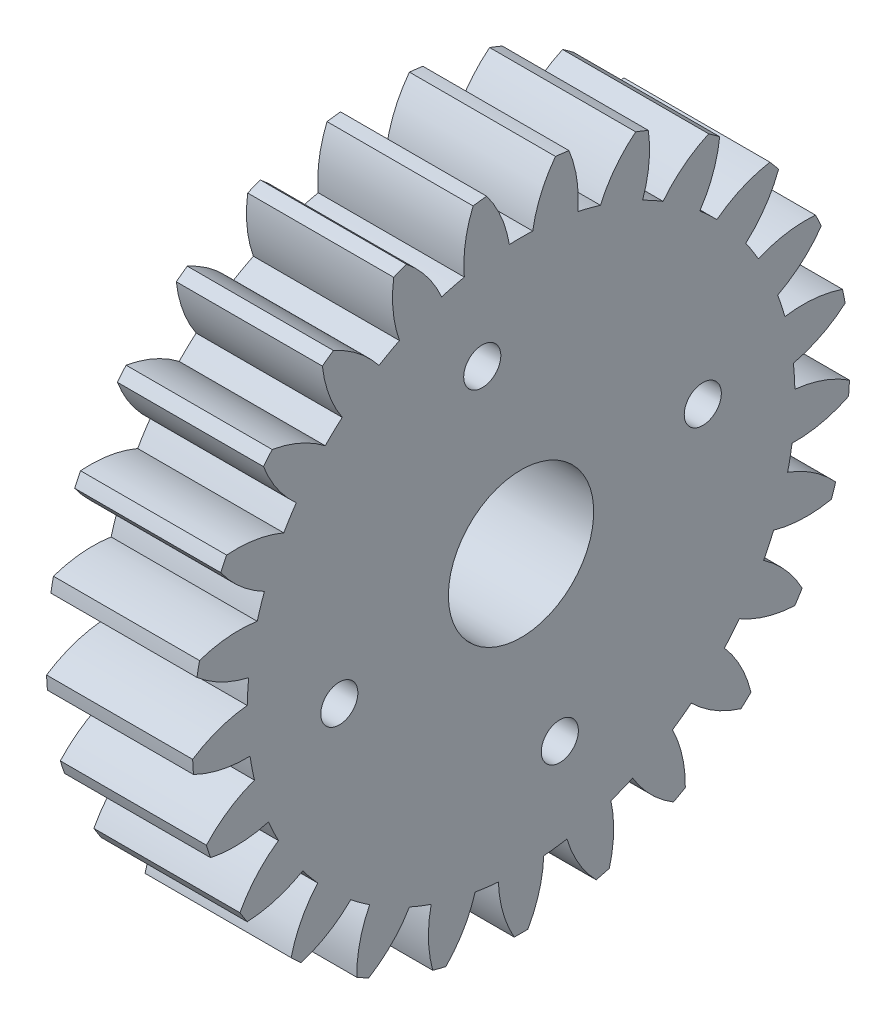
from build123d import *

# Parameters (mm, degrees)
BASPROSKE_W        = 6
BASPROSKE_H        = 13.5
TOOTHCUT_DEPTH     = 21.012496096
TEETHCUTS_COUNT    = 25
TEETHCUTS_ANGLE    = 345.6
BORSKE_R           = 2.5
BORE_DEPTH         = 50.0000508
SKETCH1_R          = 0.762
SKETCH1_R_2        = 2.9845
SKETCH1_R_3        = 2.5
CUT_EXTRUDE1_DEPTH = 149.550528118


with BuildPart() as part:
    # BasProSke → Base-Revolve (revolve)
    with BuildSketch(Plane(origin=(0, 0, 0), x_dir=(1, 0, 0), z_dir=(0, 1, 0)), mode=Mode.PRIVATE) as base_revolve_sk:
        with Locations((3, 6.75)):
            Rectangle(BASPROSKE_W, BASPROSKE_H)
    revolve(base_revolve_sk.sketch.rotate(Axis((-10, 0, 0), (1, 0, 0)), 180), axis=Axis((-10, 0, 0), (1, 0, 0)))

    # TooCutSke → ToothCut (cut, through all)
    with BuildSketch(Plane(origin=(0, 0, 0), x_dir=(0, 0, -1), z_dir=(1, 0, 0))):
        with BuildLine():
            ThreePointArc((0.480087995, 11.238750665), (0, 11.249), (-0.480087995, 11.238750665))
            ThreePointArc((-0.480087995, 11.238750665), (-0.821124963, 12.40220054), (-1.432168974, 13.449361962))
            ThreePointArc((-1.432168974, 13.449361962), (0, 13.5254), (1.432168974, 13.449361962))
            ThreePointArc((1.432168974, 13.449361962), (0.821124963, 12.40220054), (0.480087995, 11.238750665))
        make_face()
    toothcut = extrude(amount=TOOTHCUT_DEPTH, mode=Mode.SUBTRACT)

    # TeethCuts: ToothCut ×25 about axis
    teethcuts_axis = Axis((-10, 0, 0), (1, 0, 0))
    for i in range(1, TEETHCUTS_COUNT):
        add(toothcut.rotate(teethcuts_axis, i * TEETHCUTS_ANGLE / (TEETHCUTS_COUNT - 1)), mode=Mode.SUBTRACT)

    # BorSke → Bore (cut, symmetric)
    with BuildSketch(Plane(origin=(0, 0, 0), x_dir=(0, 0, -1), z_dir=(1, 0, 0))):
        with Locations(Location((0, 0, 0), (0, 0, 180))):
            Circle(BORSKE_R)
    extrude(amount=BORE_DEPTH, both=True, mode=Mode.SUBTRACT)

    # Sketch1 → Cut-Extrude1 (cut, through all)
    # profile 1 of 5: a face of its own
    with BuildSketch(Plane(origin=(0, -120.077012647, 51.383248755), x_dir=(0, 0.18176265719649715, 0.9833424309206171), z_dir=(-1, 0, 0))):
        with Locations(Location((-21.651272984, 124.49267918, 0), (0, 0, 349.527553538))):
            Circle(SKETCH1_R)
    # profile 2 of 5: a face of its own
    with BuildSketch(Plane(origin=(0, -120.077012647, 51.383248755), x_dir=(0, 0.18176265719649715, 0.9833424309206171), z_dir=(-1, 0, 0))):
        with Locations(Location((-25.778113688, 134.466916212, 0), (0, 0, 349.527553538))):
            Circle(SKETCH1_R)
    # profile 3 of 5: a face of its own
    with BuildSketch(Plane(origin=(0, -120.077012647, 51.383248755), x_dir=(0, 0.18176265719649715, 0.9833424309206171), z_dir=(-1, 0, 0))):
        with Locations(Location((-35.752350721, 130.340075507, 0), (0, 0, 349.527553538))):
            Circle(SKETCH1_R)
    # profile 4 of 5: a face of its own
    with BuildSketch(Plane(origin=(0, -120.077012647, 51.383248755), x_dir=(0, 0.18176265719649715, 0.9833424309206171), z_dir=(-1, 0, 0))):
        with Locations(Location((-31.625510016, 120.365838475, 0), (0, 0, 349.527553538))):
            Circle(SKETCH1_R)
    # profile 5 of 5: a face of its own
    with BuildSketch(Plane(origin=(0, -120.077012647, 51.383248755), x_dir=(0, 0.18176265719649715, 0.9833424309206171), z_dir=(-1, 0, 0))):
        with Locations(Location((-28.701811852, 127.416377343, 0), (0, 0, 349.527553538))):
            Circle(SKETCH1_R_2)
        with Locations((-28.701811852, 127.416377343)):
            Circle(SKETCH1_R_3, mode=Mode.SUBTRACT)
    extrude(amount=-CUT_EXTRUDE1_DEPTH, mode=Mode.SUBTRACT)


solid = part.part
